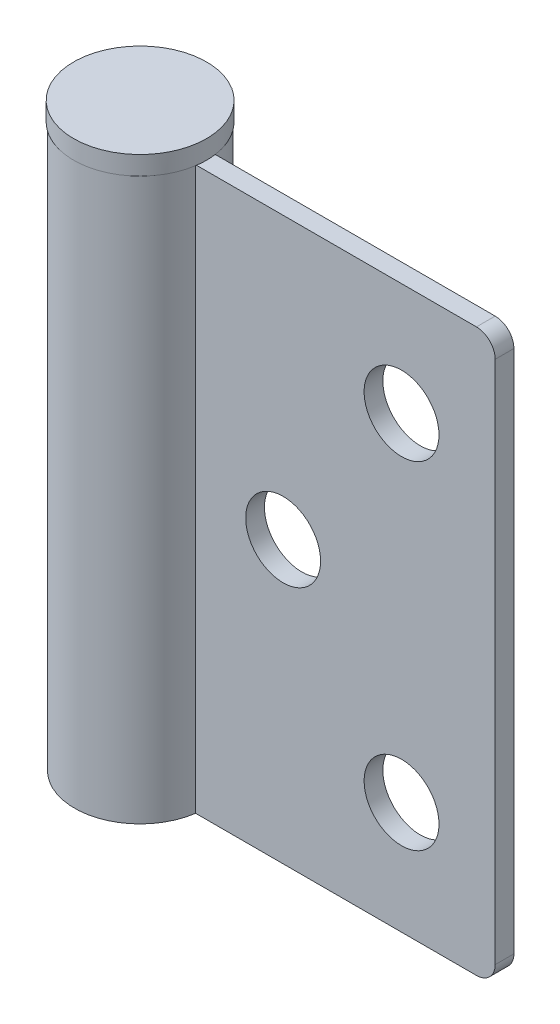
from build123d import *

# Parameters (mm, degrees)
SKETCH_1_R          = 2.5
EXTRUDE_1_DEPTH     = 30
CUT_EXTRUDE_1_REACH = 37.984
SKETCH_2_R          = 2
FILLET_1_R          = 1
SKETCH_3_R          = 3.55
EXTRUDE_2_DEPTH     = 1


with BuildPart() as part:
    # 草图1 → 凸台-拉伸1 (new body)
    with BuildSketch(Plane(origin=(0, 0, 0), x_dir=(1, 0, 0), z_dir=(0, 1, 0))):
        with BuildLine():
            Line((19.464101615, -0.5), (3.464101615, -0.5))
            ThreePointArc((3.464101615, -0.5), (-3.5, 0), (3.464101615, 0.5))
            Line((3.464101615, 0.5), (19.464101615, 0.5))
            Line((19.464101615, 0.5), (19.464101615, -0.5))
        make_face()
        with Locations(Location((0, 0, 0), (0, 0, 270))):
            Circle(SKETCH_1_R, mode=Mode.SUBTRACT)
    extrude(amount=EXTRUDE_1_DEPTH)

    # 草图2 → 切除-拉伸1 (cut, up to next)
    with BuildSketch(Plane.XY.offset(0.5), mode=Mode.PRIVATE) as cut_extrude_1_sk1:
        with Locations((14.464101615, 24)):
            Circle(SKETCH_2_R)
    cut_extrude_1_tool1 = extrude(cut_extrude_1_sk1.sketch, amount=-CUT_EXTRUDE_1_REACH, mode=Mode.PRIVATE) & part.part
    # 草图2 → 切除-拉伸1 (cut, up to next)
    with BuildSketch(Plane.XY.offset(0.5), mode=Mode.PRIVATE) as cut_extrude_1_sk2:
        with Locations((8.139546295, 15)):
            Circle(SKETCH_2_R)
    cut_extrude_1_tool2 = extrude(cut_extrude_1_sk2.sketch, amount=-CUT_EXTRUDE_1_REACH, mode=Mode.PRIVATE) & part.part
    # 草图2 → 切除-拉伸1 (cut, up to next)
    with BuildSketch(Plane.XY.offset(0.5), mode=Mode.PRIVATE) as cut_extrude_1_sk3:
        with Locations((14.464101615, 6)):
            Circle(SKETCH_2_R)
    cut_extrude_1_tool3 = extrude(cut_extrude_1_sk3.sketch, amount=-CUT_EXTRUDE_1_REACH, mode=Mode.PRIVATE) & part.part
    add(cut_extrude_1_tool1.solids().sort_by_distance((14.464102, 24, 0.5))[0], mode=Mode.SUBTRACT)
    add(cut_extrude_1_tool2.solids().sort_by_distance((8.139546, 15, 0.5))[0], mode=Mode.SUBTRACT)
    add(cut_extrude_1_tool3.solids().sort_by_distance((14.464102, 6, 0.5))[0], mode=Mode.SUBTRACT)

    # 圆角1
    fillet_1_edges = [part.edges().sort_by_distance(p)[0] for p in [
        (19.464101615, 30, 0),
        (19.464101615, 0, 0),
    ]]
    fillet(fillet_1_edges, radius=FILLET_1_R)

    # 草图3 → 凸台-拉伸2 (add)
    with BuildSketch(Plane(origin=(0, 30, 0), x_dir=(1, 0, 0), z_dir=(0, 1, 0))):
        with Locations(Location((0, 0, 0), (0, 0, 8.09674977))):
            Circle(SKETCH_3_R)
    extrude(amount=EXTRUDE_2_DEPTH)


solid = part.part
